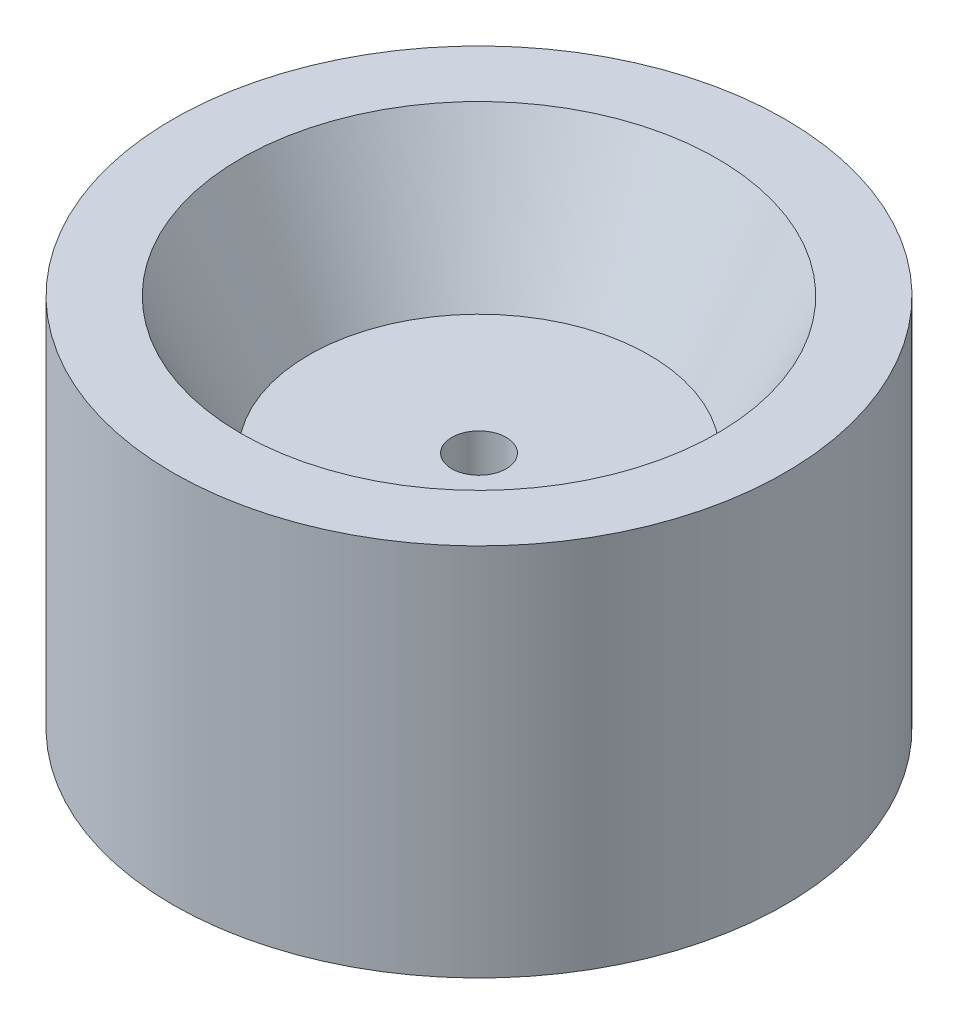
from build123d import *

# Parameters (mm, degrees)
SKETCH1_R           = 45
BOSS_EXTRUDE1_DEPTH = 55
SKETCH7_R           = 4
CUT_EXTRUDE1_DEPTH  = 15


with BuildPart() as part:
    # Sketch1 → Boss-Extrude1 (new body)
    with BuildSketch(Plane(origin=(0, 0, 0), x_dir=(1, 0, 0), z_dir=(0, 1, 0))):
        with Locations(Location((0, 0, 0), (0, 0, 270))):
            Circle(SKETCH1_R)
    extrude(amount=BOSS_EXTRUDE1_DEPTH)

    # Sketch6 → Cut-Revolve2 (revolve, cut)
    with BuildSketch(Plane(origin=(0, 0, 0), x_dir=(0, 0, -1), z_dir=(1, 0, 0))):
        Polygon((0, 55), (0, 35), (-25, 35), (-35, 55), align=None)
        Polygon((0, 0), (0, 20), (-25, 20), (-35, 0), align=None)
    revolve(axis=Axis((0, 57.084701854, 0), (0, -1, 0)), mode=Mode.SUBTRACT)

    # Sketch7 → Cut-Extrude1 (cut)
    with BuildSketch(Plane(origin=(0, 35, 0), x_dir=(1, 0, 0), z_dir=(0, 1, 0))):
        with Locations(Location((0, 0, 0), (0, 0, 270))):
            Circle(SKETCH7_R)
    extrude(amount=-CUT_EXTRUDE1_DEPTH, mode=Mode.SUBTRACT)


solid = part.part
